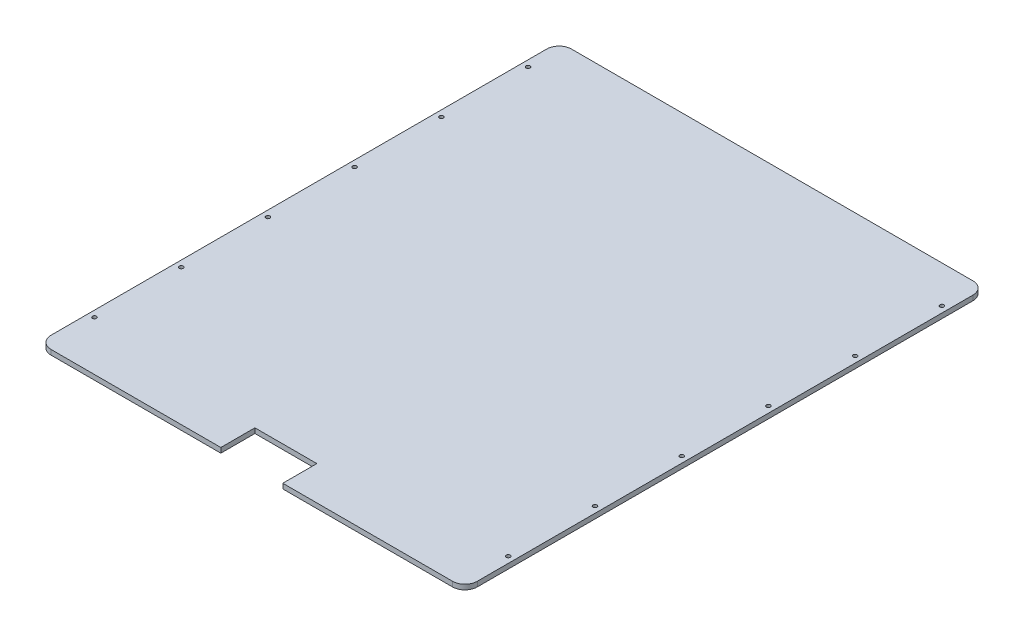
from build123d import *

# Parameters (mm, degrees)
SKETCH_1_W               = 344
SKETCH_1_H               = 420
SKETCH_1_R               = 1.6
EXTRUDE_1_DEPTH          = 2
CUT_EXTRUDE_1_DEPTH      = 272.455337026
CUT_EXTRUDE_1_DEPTH_BACK = 272.455337026
SKETCH_2_W               = 50
SKETCH_2_H               = 27.5
FILLET_1_R               = 10


with BuildPart() as part:
    # 草图1 → 凸台-拉伸1 (new, symmetric)
    with BuildSketch(Plane(origin=(0, 0, 0), x_dir=(1, 0, 0), z_dir=(0, 1, 0))):
        Rectangle(SKETCH_1_W, SKETCH_1_H)
        with Locations(Location((-167, -170, 0), (0, 0, 270))):
            Circle(SKETCH_1_R, mode=Mode.SUBTRACT)
        with Locations(Location((167, -170, 0), (0, 0, 270))):
            Circle(SKETCH_1_R, mode=Mode.SUBTRACT)
        with Locations(Location((-167, -100, 0), (0, 0, 270))):
            Circle(SKETCH_1_R, mode=Mode.SUBTRACT)
        with Locations(Location((-167, -30, 0), (0, 0, 270))):
            Circle(SKETCH_1_R, mode=Mode.SUBTRACT)
        with Locations(Location((-167, 40, 0), (0, 0, 270))):
            Circle(SKETCH_1_R, mode=Mode.SUBTRACT)
        with Locations(Location((-167, 110, 0), (0, 0, 270))):
            Circle(SKETCH_1_R, mode=Mode.SUBTRACT)
        with Locations(Location((-167, 180, 0), (0, 0, 270))):
            Circle(SKETCH_1_R, mode=Mode.SUBTRACT)
        with Locations(Location((167, -100, 0), (0, 0, 270))):
            Circle(SKETCH_1_R, mode=Mode.SUBTRACT)
        with Locations(Location((167, -30, 0), (0, 0, 270))):
            Circle(SKETCH_1_R, mode=Mode.SUBTRACT)
        with Locations(Location((167, 40, 0), (0, 0, 270))):
            Circle(SKETCH_1_R, mode=Mode.SUBTRACT)
        with Locations(Location((167, 110, 0), (0, 0, 270))):
            Circle(SKETCH_1_R, mode=Mode.SUBTRACT)
        with Locations(Location((167, 180, 0), (0, 0, 270))):
            Circle(SKETCH_1_R, mode=Mode.SUBTRACT)
    extrude(amount=EXTRUDE_1_DEPTH, both=True)

    # 草图2 → 切除-拉伸1 (cut, two sides: drawn at the far end of the back side and taken through both)
    with BuildSketch(Plane(origin=(0, 0, 0), x_dir=(1, 0, 0), z_dir=(0, 1, 0)).offset(-CUT_EXTRUDE_1_DEPTH_BACK)):
        with Locations((0, -196.25)):
            Rectangle(SKETCH_2_W, SKETCH_2_H)
    extrude(amount=CUT_EXTRUDE_1_DEPTH + CUT_EXTRUDE_1_DEPTH_BACK, mode=Mode.SUBTRACT)

    # 圆角1
    fillet_1_edges = [part.edges().sort_by_distance(p)[0] for p in [
        (-172, 0, -210),
        (172, 0, -210),
        (172, 0, 210),
        (-172, 0, 210),
    ]]
    fillet(fillet_1_edges, radius=FILLET_1_R)


solid = part.part
